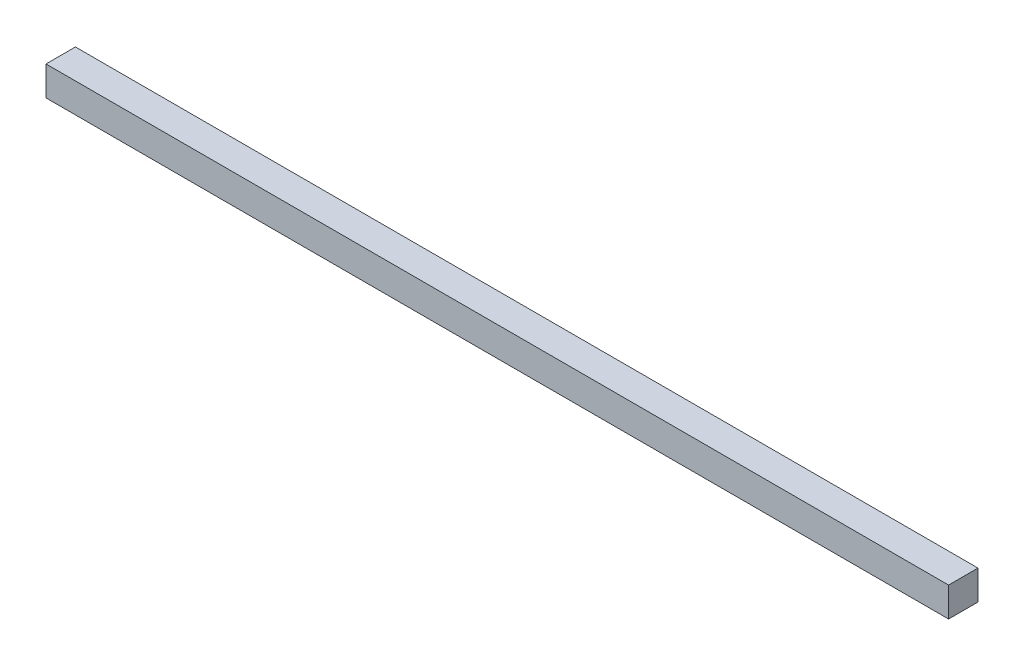
from build123d import *

# Parameters (mm, degrees)
SKETCH1_W           = 1168.4
SKETCH1_H           = 38.1
BOSS_EXTRUDE1_DEPTH = 38.1


with BuildPart() as part:
    # Sketch1 → Boss-Extrude1 (new body)
    with BuildSketch(Plane.XY):
        Rectangle(SKETCH1_W, SKETCH1_H)
    extrude(amount=BOSS_EXTRUDE1_DEPTH)


solid = part.part
